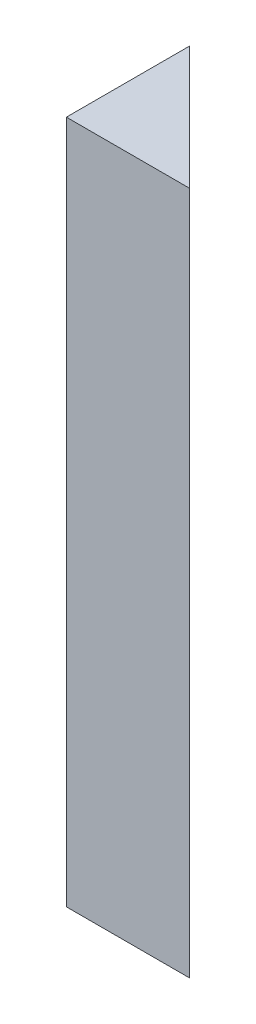
from build123d import *

# Parameters (mm, degrees)
BOSS_EXTRUDE1_DEPTH = 111


with BuildPart() as part:
    # Sketch2 → Boss-Extrude1 (new body)
    with BuildSketch(Plane(origin=(0, 0, 0), x_dir=(1, 0, 0), z_dir=(0, 1, 0))):
        Polygon((-10, 10), (10, -10), (-10, -10), align=None)
    extrude(amount=BOSS_EXTRUDE1_DEPTH)


solid = part.part
